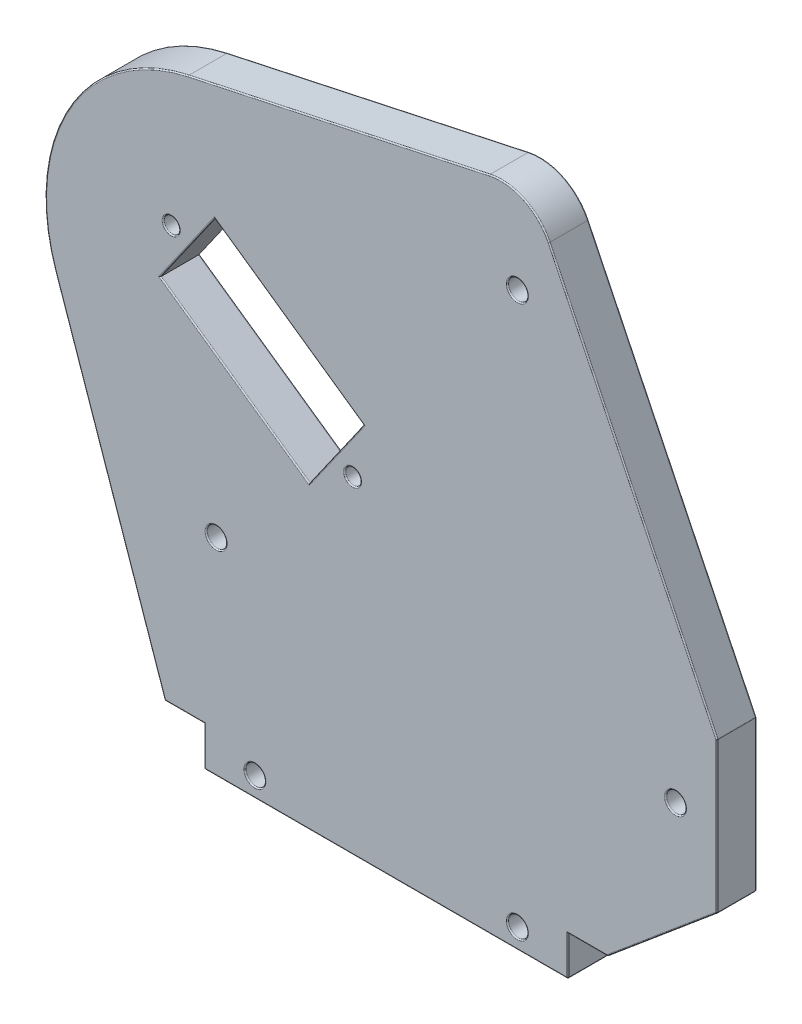
from build123d import *

# Parameters (mm, degrees)
SKETCH_1_R          = 1
EXTRUDE_1_DEPTH     = 5
HOLE_WIZARD_M3_1_D  = 2.5
FILLET_1_R          = 0.15
SKETCH_4_W          = 46
SKETCH_4_H          = 5
CUT_EXTRUDE_1_DEPTH = 99.373284654
FILLET_2_R          = 0.15


with BuildPart() as part:
    # 草图1 → 凸台-拉伸1 (new body)
    with BuildSketch(Plane.XY):
        with BuildLine():
            Line((-25.029728066, 79.943634341), (13.072325527, 88.138211024))
            ThreePointArc((13.072325527, 88.138211024), (17.477220077, 87.602479874), (20.610605748, 84.460506273))
            Line((20.610605748, 84.460506273), (41.85, 40.621529892))
            Line((41.85, 40.621529892), (41.85, 21.621529892))
            Line((41.85, 21.621529892), (28, 10))
            Line((28, 10), (23, 10))
            Line((23, 10), (23, 0))
            Line((23, 0), (-23, 0))
            Line((-23, 0), (-23, 10))
            Line((-23, 10), (-28, 10))
            Line((-28, 10), (-41.843761624, 50.118193368))
            ThreePointArc((-41.843761624, 50.118193368), (-40.146654928, 68.813612437), (-25.029728066, 79.943634341))
        make_face()
        with Locations((-27.182792376, 62.455399709)):
            Circle(SKETCH_1_R, mode=Mode.SUBTRACT)
        with Locations(Location((-4.246535136, 46.395259491, 0), (0, 0, 180))):
            Circle(SKETCH_1_R, mode=Mode.SUBTRACT)
        Polygon((-28.576370884, 56.106546352), (-21.693453648, 65.936370884), (-2.852956629, 52.744112848), (-9.735873865, 42.914288316), align=None, mode=Mode.SUBTRACT)
    extrude(amount=EXTRUDE_1_DEPTH)

    # M3 螺纹孔的螺纹孔钻头1 (through all)
    with Locations(Plane.XY.offset(5)):
        with Locations((16.6, 77.2733483), (36.6, 31.121529892), (16.6, 7.5), (-16.6, 7.5), (-21.5, 31.121529892)):
            Hole(HOLE_WIZARD_M3_1_D / 2)

    # 圆角1
    fillet_1_edges = [part.edges().sort_by_distance(p)[0] for p in [
        (31.230302874, 62.541018083, 0),
        (41.85, 31.121529892, 0),
        (-40.146654928, 68.813612437, 5),
        (34.925, 15.810764946, 0),
        (25.5, 10, 0),
        (23, 5, 0),
        (0, 0, 0),
        (-23, 5, 0),
        (-25.5, 10, 0),
        (-34.921880812, 30.059096684, 0),
        (-40.146654928, 68.813612437, 0),
        (-5.978701269, 84.040922682, 0),
        (17.477220077, 87.602479874, 0),
        (-34.921880812, 30.059096684, 5),
        (41.85, 40.621529892, 2.5),
        (41.85, 21.621529892, 2.5),
        (-25.5, 10, 5),
        (28, 10, 2.5),
        (23, 0, 2.5),
        (-23, 0, 2.5),
        (-28, 10, 2.5),
        (-23, 5, 5),
        (0, 0, 5),
        (23, 5, 5),
        (-19.156122375, 49.510417334, 0),
        (-6.294415247, 47.829200582, 0),
        (-12.273205138, 59.340241866, 0),
        (-25.134912266, 61.021458618, 0),
        (-19.156122375, 49.510417334, 5),
        (-6.294415247, 47.829200582, 5),
        (-12.273205138, 59.340241866, 5),
        (-25.134912266, 61.021458618, 5),
        (25.5, 10, 5),
        (34.925, 15.810764946, 5),
        (-28.182792376, 62.455399709, 0),
        (-28.182792376, 62.455399709, 5),
        (41.85, 31.121529892, 5),
        (-3.246535136, 46.395259491, 0),
        (-3.246535136, 46.395259491, 5),
        (31.230302874, 62.541018083, 5),
        (17.477220077, 87.602479874, 5),
        (-20.25, 31.121529892, 5),
        (-20.25, 31.121529892, 0),
        (-15.35, 7.5, 5),
        (-15.35, 7.5, 0),
        (17.85, 7.5, 5),
        (17.85, 7.5, 0),
        (37.85, 31.121529892, 5),
        (37.85, 31.121529892, 0),
        (17.85, 77.2733483, 5),
        (17.85, 77.2733483, 0),
        (-5.978701269, 84.040922682, 5),
    ]]
    fillet(fillet_1_edges, radius=FILLET_1_R)

    # 草图4 → 切除-拉伸1 (cut, through all)
    with BuildSketch(Plane(origin=(0, 0, 0), x_dir=(-1, 0, 0), z_dir=(0, 0, -1))):
        with Locations((0, 2.5)):
            Rectangle(SKETCH_4_W, SKETCH_4_H)
    extrude(amount=-CUT_EXTRUDE_1_DEPTH, mode=Mode.SUBTRACT)

    # 圆角2
    fillet_2_edges = [part.edges().sort_by_distance(p)[0] for p in [
        (-22.956066017, 5, 0.043933983),
        (22.956066017, 5, 4.956066017),
        (22.956066017, 5, 0.043933983),
        (-22.956066017, 5, 4.956066017),
        (23, 5, 2.5),
        (0, 5, 5),
        (-23, 5, 2.5),
        (0, 5, 0),
    ]]
    fillet(fillet_2_edges, radius=FILLET_2_R)


solid = part.part
